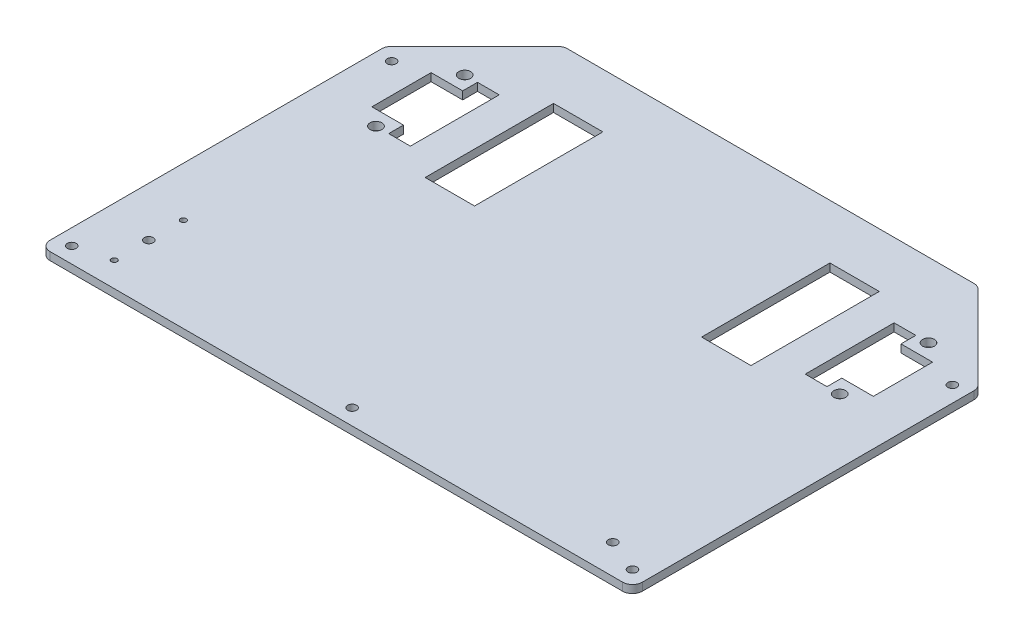
from build123d import *

# Parameters (mm, degrees)
MAIN_EXTRUSION_DEPTH    = 4
CORNER_LEAVE_R          = 5
ESQUISSE2_R             = 3
ESQUISSE2_W             = 25
ESQUISSE2_H             = 65
ENL_V_MAT_EXTRU_1_DEPTH = 267.30058205
D_GAGEMENT_M41_D        = 4.5
D_GAGEMENT_M42_D        = 4.5
D_GAGEMENT_M2_51_D      = 2.9


with BuildPart() as part:
    # Main scetch → Main extrusion (new body)
    with BuildSketch(Plane(origin=(0, 0, 0), x_dir=(1, 0, 0), z_dir=(0, 1, 0))):
        Polygon((-150, 0), (150, 0), (150, 175), (105, 220), (-105, 220), (-150, 175), align=None)
    extrude(amount=MAIN_EXTRUSION_DEPTH)

    # Corner leave
    corner_leave_edges = [part.edges().sort_by_distance(p)[0] for p in [
        (150, 2, 0),
        (-150, 2, 0),
        (-150, 2, -175),
        (-105, 2, -220),
        (105, 2, -220),
        (150, 2, -175),
    ]]
    fillet(corner_leave_edges, radius=CORNER_LEAVE_R)

    # Esquisse2 → Enlèv. mat.-Extru.1 (cut, through all)
    with BuildSketch(Plane(origin=(0, 4, 0), x_dir=(1, 0, 0), z_dir=(0, 1, 0))):
        with Locations(Location((117.47, 182.47, 0), (0, 0, 270))):
            Circle(ESQUISSE2_R)
        with Locations(Location((117.47, 137.53, 0), (0, 0, 90))):
            Circle(ESQUISSE2_R)
        with Locations(Location((-117.47, 137.53, 0), (0, 0, 270))):
            Circle(ESQUISSE2_R)
        with Locations(Location((-117.47, 182.47, 0), (0, 0, 90))):
            Circle(ESQUISSE2_R)
        with Locations((70, 160)):
            Rectangle(ESQUISSE2_W, ESQUISSE2_H)
        Polygon((100, 137.5), (100, 182.5), (111, 182.5), (111, 175), (127, 175), (127, 145), (111, 145), (111, 137.5), align=None)
        Polygon((-111, 137.5), (-111, 145), (-127, 145), (-127, 175), (-111, 175), (-111, 182.5), (-100, 182.5), (-100, 137.5), align=None)
        with Locations((-70, 160)):
            Rectangle(ESQUISSE2_W, ESQUISSE2_H)
    extrude(amount=-ENL_V_MAT_EXTRU_1_DEPTH, mode=Mode.SUBTRACT)

    # Dégagement M41 (through all)
    with Locations(Plane(origin=(0, 4, 0), x_dir=(1, 0, 0), z_dir=(0, 1, 0))):
        with Locations((-125, 30), (125, 15)):
            Hole(D_GAGEMENT_M41_D / 2)

    # Dégagement M42 (through all)
    with Locations(Plane(origin=(0, 4, 0), x_dir=(1, 0, 0), z_dir=(0, 1, 0))):
        with Locations((-142, 8), (0, 8), (142, 8), (142, 170), (-142, 170)):
            Hole(D_GAGEMENT_M42_D / 2)

    # Dégagement M2.51 (through all)
    with Locations(Plane(origin=(0, 4, 0), x_dir=(1, 0, 0), z_dir=(0, 1, 0))):
        with Locations((-125, 47.5), (-125, 12.5)):
            Hole(D_GAGEMENT_M2_51_D / 2)


solid = part.part
